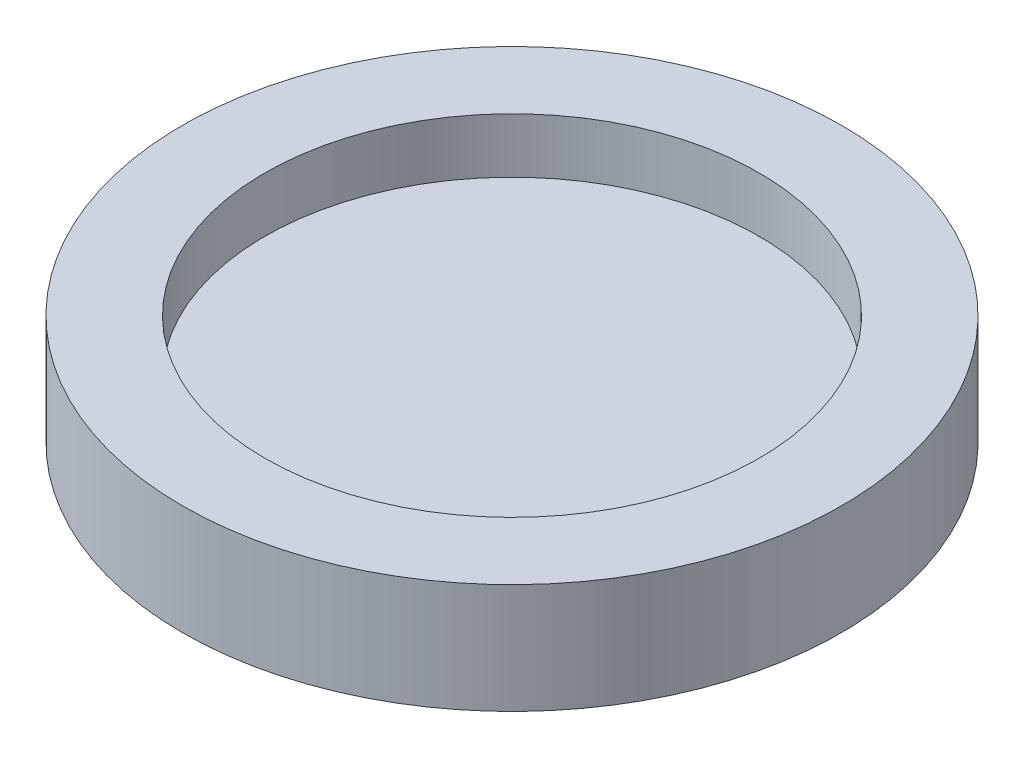
from build123d import *

# Parameters (mm, degrees)
SKETCH1_R           = 60
BOSS_EXTRUDE1_DEPTH = 20
SKETCH2_R           = 45
CUT_EXTRUDE1_DEPTH  = 10


with BuildPart() as part:
    # Sketch1 → Boss-Extrude1 (new body)
    with BuildSketch(Plane(origin=(0, 0, 0), x_dir=(1, 0, 0), z_dir=(0, 1, 0))):
        with Locations(Location((0, 0, 0), (0, 0, 270))):
            Circle(SKETCH1_R)
    extrude(amount=-BOSS_EXTRUDE1_DEPTH)

    # Sketch2 → Cut-Extrude1 (cut)
    with BuildSketch(Plane(origin=(0, 0, 0), x_dir=(1, 0, 0), z_dir=(0, 1, 0))):
        with Locations(Location((0, 0, 0), (0, 0, 270))):
            Circle(SKETCH2_R)
    extrude(amount=-CUT_EXTRUDE1_DEPTH, mode=Mode.SUBTRACT)


solid = part.part
